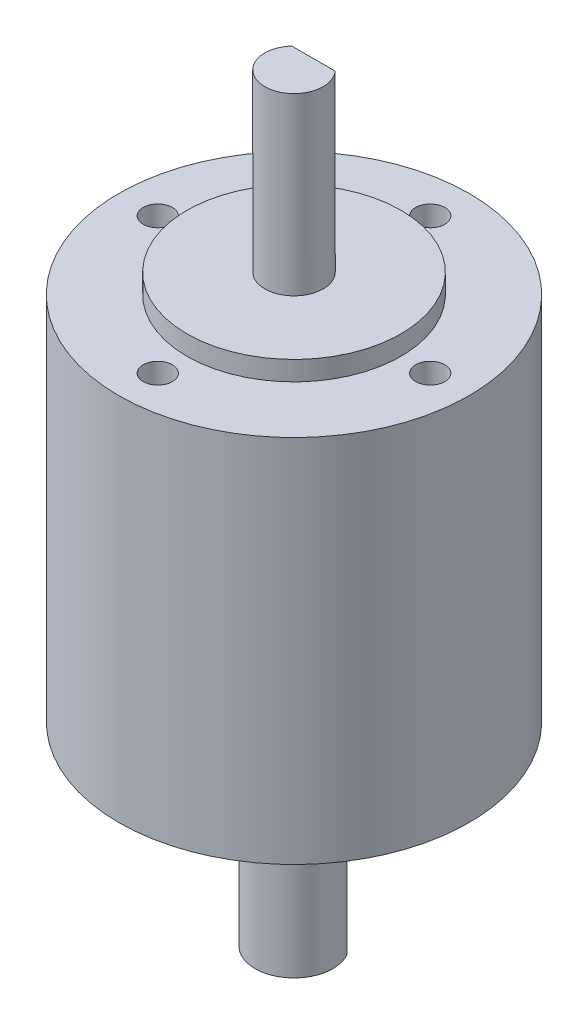
from build123d import *

# Parameters (mm, degrees)
SKETCH_1_R          = 18
EXTRUDE_1_DEPTH     = 38
SKETCH_2_R          = 11
EXTRUDE_2_DEPTH     = 2
EXTRUDE_START       = 2
SKETCH_3_R          = 11
EXTRUDE_3_DEPTH     = 2
SKETCH_4_R          = 4
EXTRUDE_4_DEPTH     = 18
SKETCH_5_R          = 3
EXTRUDE_5_DEPTH     = 18
SKETCH_6_W          = 9.252434457
SKETCH_6_H          = 4.602247191
CUT_EXTRUDE_1_DEPTH = 15
SKETCH_7_W          = 9.252434457
SKETCH_7_H          = 4.602247191
CUT_EXTRUDE_2_DEPTH = 15
SKETCH_8_R          = 1.5
CUT_EXTRUDE_3_DEPTH = 6
CUT_EXTRUDE_START   = -6
SKETCH_9_R          = 1.5
CUT_EXTRUDE_4_DEPTH = 6


with BuildPart() as part:
    # 草图1 → 凸台-拉伸1 (new body)
    with BuildSketch(Plane(origin=(0, 0, 0), x_dir=(1, 0, 0), z_dir=(0, 1, 0))):
        with Locations(Location((0, 0, 0), (0, 0, 270))):
            Circle(SKETCH_1_R)
    extrude(amount=EXTRUDE_1_DEPTH)

    # 草图2 → 凸台-拉伸2 (add)
    with BuildSketch(Plane(origin=(0, 38, 0), x_dir=(1, 0, 0), z_dir=(0, 1, 0))):
        with Locations(Location((0, 0, 0), (0, 0, 270))):
            Circle(SKETCH_2_R)
    extrude(amount=EXTRUDE_2_DEPTH)

    # 草图3 → 凸台-拉伸3 (add)
    with BuildSketch(Plane.XZ.offset(EXTRUDE_START)):
        with Locations(Location((0, 0, 0), (0, 0, 90))):
            Circle(SKETCH_3_R)
    extrude(amount=-EXTRUDE_3_DEPTH)

    # 草图4 → 凸台-拉伸4 (add)
    with BuildSketch(Plane.XZ.offset(2)):
        with Locations(Location((0, 0, 0), (0, 0, 270))):
            Circle(SKETCH_4_R)
    extrude(amount=EXTRUDE_4_DEPTH)

    # 草图5 → 凸台-拉伸5 (add)
    with BuildSketch(Plane(origin=(0, 40, 0), x_dir=(1, 0, 0), z_dir=(0, 1, 0))):
        with Locations(Location((0, 0, 0), (0, 0, 270))):
            Circle(SKETCH_5_R)
    extrude(amount=EXTRUDE_5_DEPTH)

    # 草图6 → 切除-拉伸1 (cut)
    with BuildSketch(Plane(origin=(0, 58, 0), x_dir=(1, 0, 0), z_dir=(0, 1, 0))):
        with Locations((-0.167790263, 4.301123596)):
            Rectangle(SKETCH_6_W, SKETCH_6_H)
    extrude(amount=-CUT_EXTRUDE_1_DEPTH, mode=Mode.SUBTRACT)

    # 草图7 → 切除-拉伸2 (cut)
    with BuildSketch(Plane.XZ.offset(20)):
        with Locations((-0.167790263, -4.301123596)):
            Rectangle(SKETCH_7_W, SKETCH_7_H)
    extrude(amount=-CUT_EXTRUDE_2_DEPTH, mode=Mode.SUBTRACT)

    # 草图8 → 切除-拉伸3 (cut)
    with BuildSketch(Plane.XZ):
        with Locations(Location((0, 14, 0), (0, 0, 270))):
            Circle(SKETCH_8_R)
        with Locations(Location((14, 0, 0), (0, 0, 270))):
            Circle(SKETCH_8_R)
        with Locations(Location((0, -14, 0), (0, 0, 270))):
            Circle(SKETCH_8_R)
        with Locations(Location((-14, 0, 0), (0, 0, 270))):
            Circle(SKETCH_8_R)
    extrude(amount=-CUT_EXTRUDE_3_DEPTH, mode=Mode.SUBTRACT)

    # 草图9 → 切除-拉伸4 (cut)
    with BuildSketch(Plane(origin=(0, 38, 0), x_dir=(1, 0, 0), z_dir=(0, 1, 0)).offset(CUT_EXTRUDE_START)):
        with Locations(Location((-14, 0, 0), (0, 0, 90))):
            Circle(SKETCH_9_R)
        with Locations(Location((0, 14, 0), (0, 0, 90))):
            Circle(SKETCH_9_R)
        with Locations(Location((14, 0, 0), (0, 0, 90))):
            Circle(SKETCH_9_R)
        with Locations(Location((0, -14, 0), (0, 0, 90))):
            Circle(SKETCH_9_R)
    extrude(amount=CUT_EXTRUDE_4_DEPTH, mode=Mode.SUBTRACT)


solid = part.part
